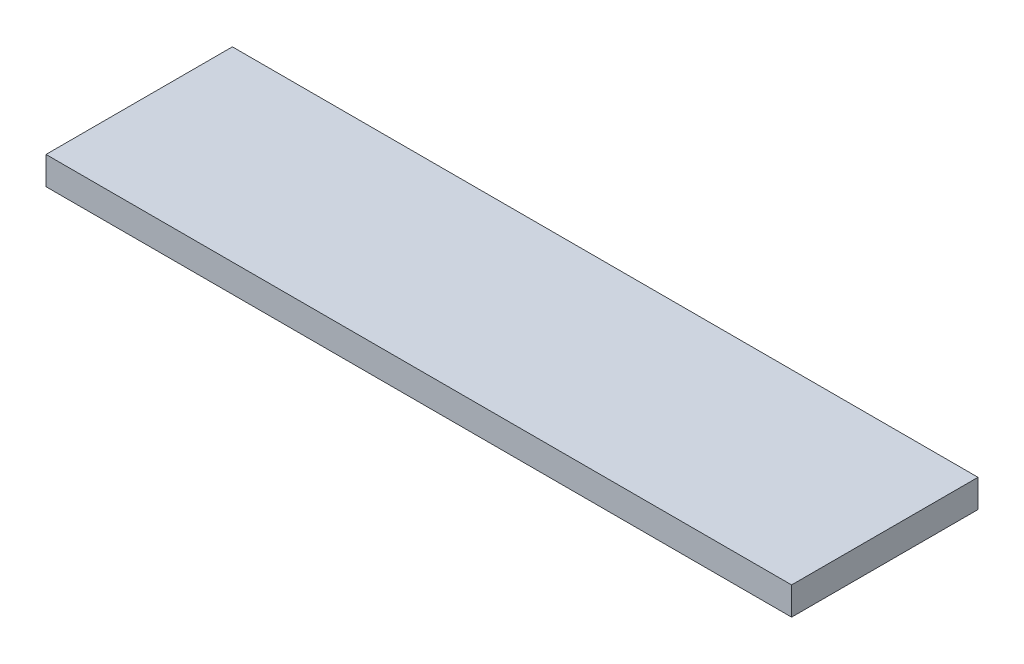
from build123d import *

# Parameters (mm, degrees)
SKETCH2_W           = 63.5
SKETCH2_H           = 15.875
BOSS_EXTRUDE1_DEPTH = 2.38125
CUT_EXTRUDE1_REACH  = 34.814
SKETCH3_R           = 0.0127


with BuildPart() as part:
    # Sketch2 → Boss-Extrude1 (new body)
    with BuildSketch(Plane(origin=(0, 0, 0), x_dir=(1, 0, 0), z_dir=(0, 1, 0))):
        Rectangle(SKETCH2_W, SKETCH2_H)
    extrude(amount=BOSS_EXTRUDE1_DEPTH)

    # Sketch3 → Cut-Extrude1 (cut, up to next)
    with BuildSketch(Plane(origin=(0, 2.38125, 0), x_dir=(1, 0, 0), z_dir=(0, 1, 0)), mode=Mode.PRIVATE) as cut_extrude1_sk1:
        with Locations(Location((0, 0, 0), (0, 0, 270))):
            Circle(SKETCH3_R)
    cut_extrude1_tool1 = extrude(cut_extrude1_sk1.sketch, amount=-CUT_EXTRUDE1_REACH, mode=Mode.PRIVATE) & part.part
    add(cut_extrude1_tool1.solids().sort_by_distance((0, 2.38125, 0))[0], mode=Mode.SUBTRACT)


solid = part.part
